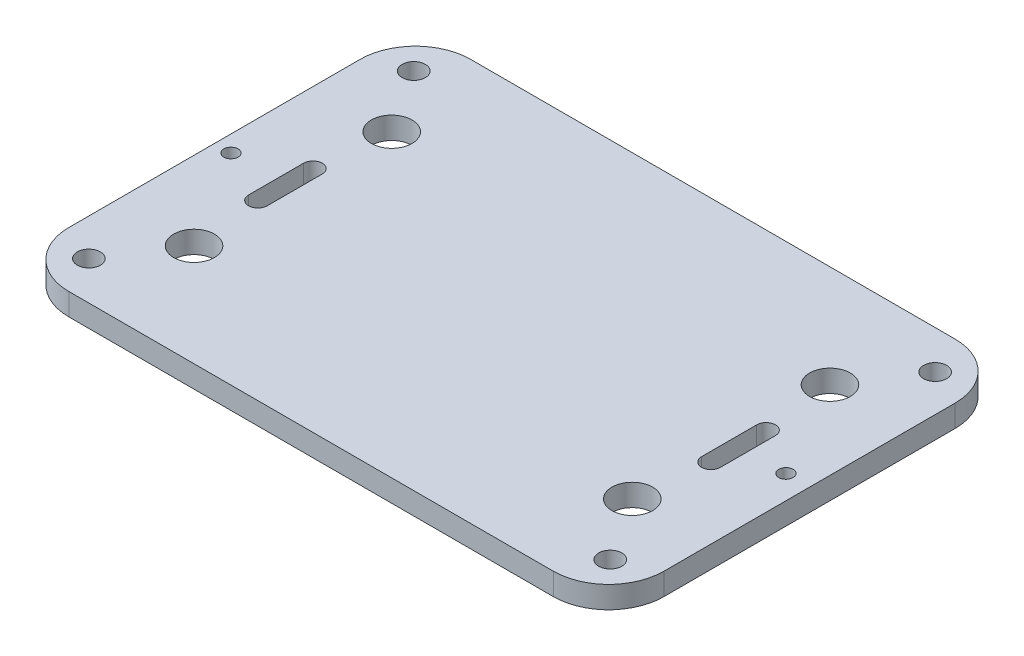
from build123d import *

# Parameters (mm, degrees)
SCHIZZO1_R                   = 2.1
SCHIZZO1_R_2                 = 3.7
SCHIZZO1_R_3                 = 1.3
ESTRUSIONE_ESTRUSIONE1_DEPTH = 4


with BuildPart() as part:
    # Schizzo1 → Estrusione-Estrusione1 (new body)
    with BuildSketch(Plane(origin=(0, 0, 0), x_dir=(1, 0, 0), z_dir=(0, 1, 0))):
        with BuildLine():
            Line((-10.05, 0), (-98.05, 0))
            ThreePointArc((-98.05, 0), (-105.156423151, 2.943576849), (-108.1, 10.05))
            Line((-108.1, 10.05), (-108.1, 62.95))
            ThreePointArc((-108.1, 62.95), (-105.156423151, 70.056423151), (-98.05, 73))
            Line((-98.05, 73), (-10.05, 73))
            ThreePointArc((-10.05, 73), (-2.943576849, 70.056423151), (0, 62.95))
            Line((0, 62.95), (0, 10.05))
            ThreePointArc((0, 10.05), (-2.943576849, 2.943576849), (-10.05, 0))
        make_face()
        with Locations(Location((-6.7, 66, 0), (0, 0, 270))):
            Circle(SCHIZZO1_R, mode=Mode.SUBTRACT)
        with Locations(Location((-6.7, 7, 0), (0, 0, 270))):
            Circle(SCHIZZO1_R, mode=Mode.SUBTRACT)
        with Locations(Location((-101.4, 66, 0), (0, 0, 270))):
            Circle(SCHIZZO1_R, mode=Mode.SUBTRACT)
        with Locations(Location((-101.4, 7, 0), (0, 0, 270))):
            Circle(SCHIZZO1_R, mode=Mode.SUBTRACT)
        with Locations(Location((-93.85, 54.45, 0), (0, 0, 270))):
            Circle(SCHIZZO1_R_2, mode=Mode.SUBTRACT)
        with Locations(Location((-93.85, 18.55, 0), (0, 0, 270))):
            Circle(SCHIZZO1_R_2, mode=Mode.SUBTRACT)
        with Locations(Location((-14.25, 18.55, 0), (0, 0, 270))):
            Circle(SCHIZZO1_R_2, mode=Mode.SUBTRACT)
        with Locations(Location((-14.25, 54.45, 0), (0, 0, 270))):
            Circle(SCHIZZO1_R_2, mode=Mode.SUBTRACT)
        with Locations(Location((-4.3, 36.5, 0), (0, 0, 270))):
            Circle(SCHIZZO1_R_3, mode=Mode.SUBTRACT)
        with Locations(Location((-105.1, 36.5, 0), (0, 0, 270))):
            Circle(SCHIZZO1_R_3, mode=Mode.SUBTRACT)
        with BuildLine():
            Line((-96.9, 31.5), (-96.9, 41.5))
            ThreePointArc((-96.9, 41.5), (-95.2, 43.2), (-93.5, 41.5))
            Line((-93.5, 41.5), (-93.5, 31.5))
            ThreePointArc((-93.5, 31.5), (-95.2, 29.8), (-96.9, 31.5))
        make_face(mode=Mode.SUBTRACT)
        with BuildLine():
            Line((-14.6, 31.5), (-14.6, 41.5))
            ThreePointArc((-14.6, 41.5), (-12.9, 43.2), (-11.2, 41.5))
            Line((-11.2, 41.5), (-11.2, 31.5))
            ThreePointArc((-11.2, 31.5), (-12.9, 29.8), (-14.6, 31.5))
        make_face(mode=Mode.SUBTRACT)
    extrude(amount=ESTRUSIONE_ESTRUSIONE1_DEPTH)


solid = part.part
